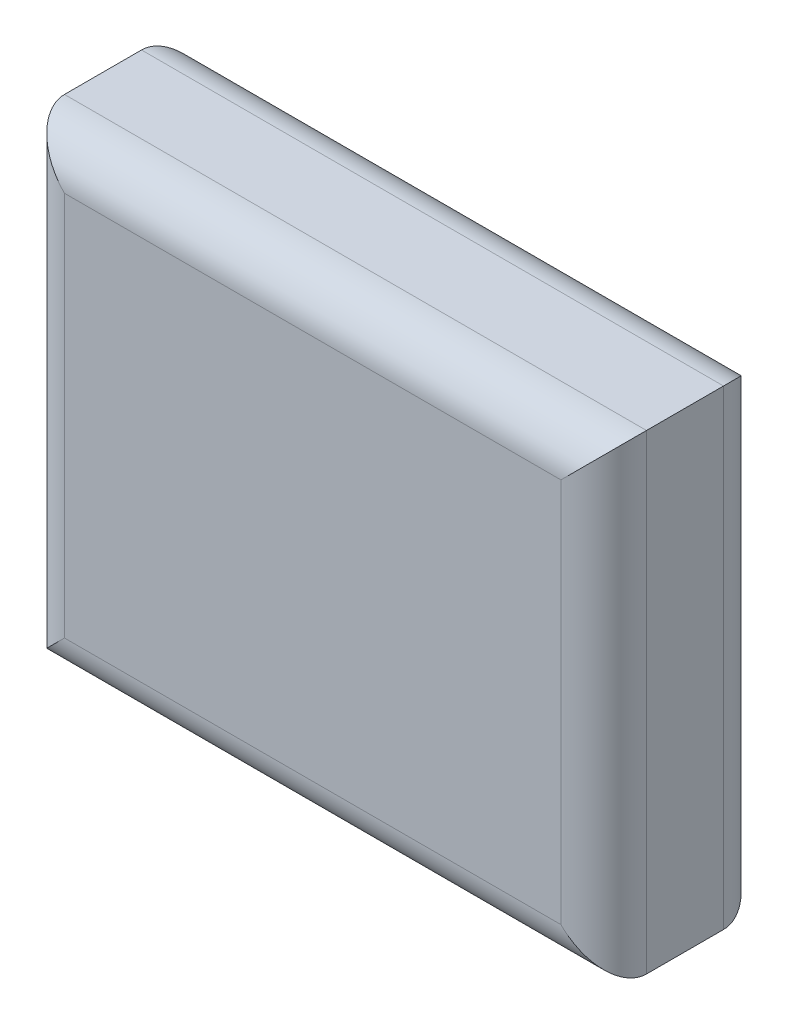
from build123d import *

# Parameters (mm, degrees)
SKETCH_1_W      = 68
SKETCH_1_H      = 55
EXTRUDE_1_DEPTH = 19
FILLET_1_R      = 5


with BuildPart() as part:
    # 草图1 → 凸台-拉伸1 (new body)
    with BuildSketch(Plane.XY):
        Rectangle(SKETCH_1_W, SKETCH_1_H)
    extrude(amount=EXTRUDE_1_DEPTH)

    # 圆角1
    fillet_1_edges = [part.edges().sort_by_distance(p)[0] for p in [
        (34, 0, 19),
        (0, 27.5, 19),
        (-34, 0, 19),
        (0, 27.5, 0),
        (34, 0, 0),
        (0, -27.5, 0),
        (-34, 0, 0),
        (0, -27.5, 19),
    ]]
    fillet(fillet_1_edges, radius=FILLET_1_R)


solid = part.part
